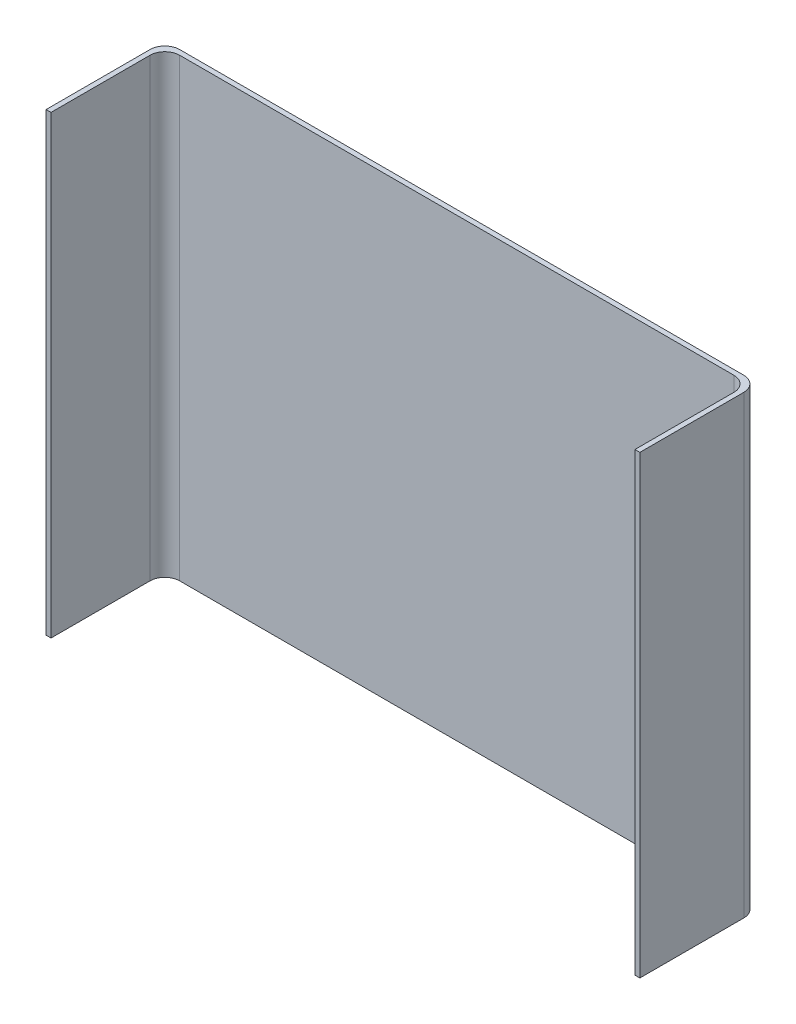
from build123d import *

# Parameters (mm, degrees)
SKETCH1_W           = 120
SKETCH1_H           = 92
BOSS_EXTRUDE1_DEPTH = 1
SKETCH2_W           = 1
SKETCH2_H           = 92
BOSS_EXTRUDE2_DEPTH = 23
FILLET1_R           = 3
FILLET2_R           = 3
FILLET3_R           = 3


with BuildPart() as part:
    # Sketch1 → Boss-Extrude1 (new body)
    with BuildSketch(Plane.XY):
        Rectangle(SKETCH1_W, SKETCH1_H)
    extrude(amount=BOSS_EXTRUDE1_DEPTH)

    # Sketch2 → Boss-Extrude2 (add)
    with BuildSketch(Plane.XY.offset(1)):
        with Locations((-59.5, 0)):
            Rectangle(SKETCH2_W, SKETCH2_H)
    boss_extrude2 = extrude(amount=BOSS_EXTRUDE2_DEPTH)

    # Fillet1
    fillet1_edges = [part.edges().sort_by_distance(p)[0] for p in [
        (-60, 0, 0),
    ]]
    fillet(fillet1_edges, radius=FILLET1_R)

    # Fillet2
    fillet2_edges = [part.edges().sort_by_distance(p)[0] for p in [
        (-59, 0, 1),
    ]]
    fillet(fillet2_edges, radius=FILLET2_R)

    # Mirror3: Boss-Extrude2 across plane
    add(boss_extrude2.mirror(Plane(origin=(0, 0, 0), x_dir=(0, 0, 1), z_dir=(1, 0, 0))))

    # Fillet3
    fillet3_edges = [part.edges().sort_by_distance(p)[0] for p in [
        (59, 0, 1),
        (60, 0, 0),
    ]]
    fillet(fillet3_edges, radius=FILLET3_R)


solid = part.part
